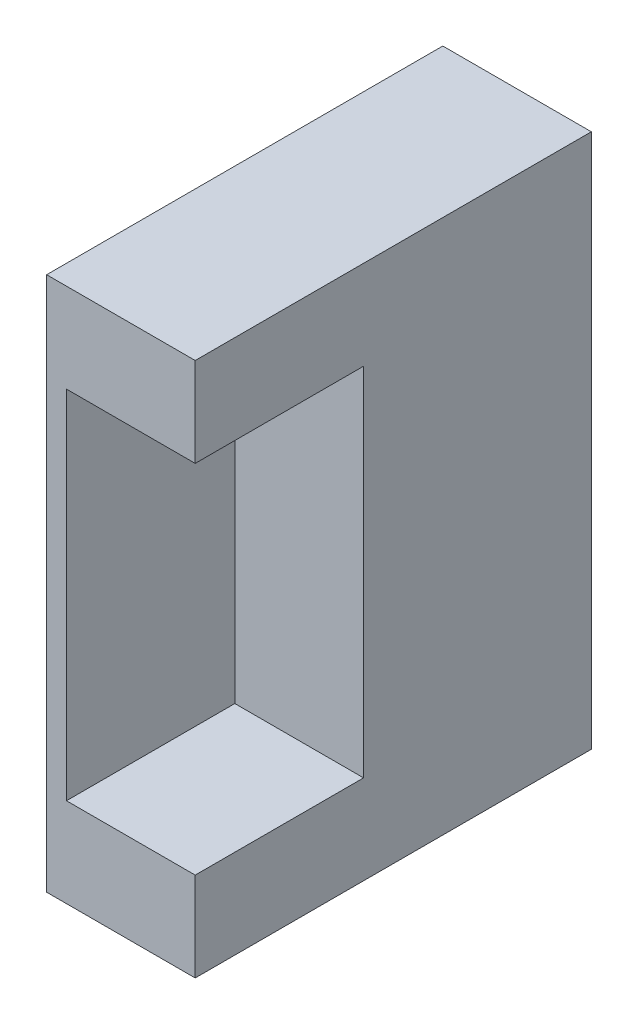
from build123d import *

# Parameters (mm, degrees)
SKETCH1_W           = 68.58
SKETCH1_H           = 50.8
BOSS_EXTRUDE1_DEPTH = 19.05
SKETCH2_W           = 45.72
SKETCH2_H           = 21.59
CUT_EXTRUDE1_DEPTH  = 16.51


with BuildPart() as part:
    # Sketch1 → Boss-Extrude1 (new body)
    with BuildSketch(Plane.YZ):
        with Locations((34.29, 25.4)):
            Rectangle(SKETCH1_W, SKETCH1_H)
    extrude(amount=BOSS_EXTRUDE1_DEPTH)

    # Sketch2 → Cut-Extrude1 (cut)
    with BuildSketch(Plane.YZ.offset(19.05)):
        with Locations((34.29, 40.005)):
            Rectangle(SKETCH2_W, SKETCH2_H)
    extrude(amount=-CUT_EXTRUDE1_DEPTH, mode=Mode.SUBTRACT)


solid = part.part
